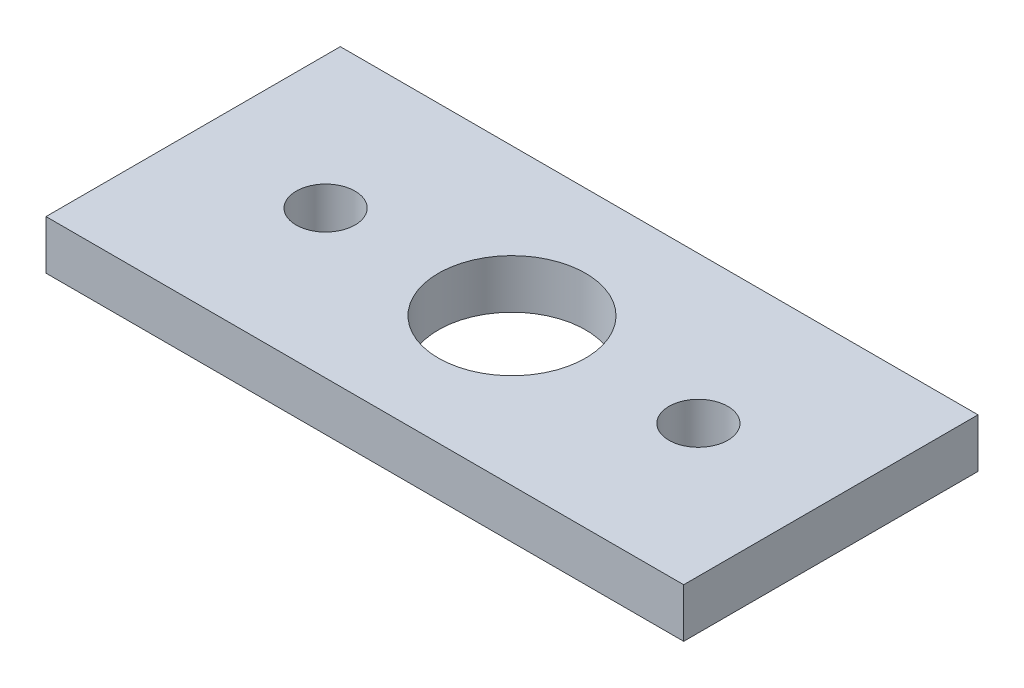
from build123d import *

# Parameters (mm, degrees)
SKETCH1_W           = 65
SKETCH1_H           = 30
SKETCH1_R           = 7.5
SKETCH1_R_2         = 3
BOSS_EXTRUDE1_DEPTH = 5


with BuildPart() as part:
    # Sketch1 → Boss-Extrude1 (new body)
    with BuildSketch(Plane(origin=(0, 0, 0), x_dir=(1, 0, 0), z_dir=(0, 1, 0))):
        with Locations((32.5, 15)):
            Rectangle(SKETCH1_W, SKETCH1_H)
        with Locations(Location((32.5, 15, 0), (0, 0, 270))):
            Circle(SKETCH1_R, mode=Mode.SUBTRACT)
        with Locations(Location((13.5, 15, 0), (0, 0, 270))):
            Circle(SKETCH1_R_2, mode=Mode.SUBTRACT)
        with Locations(Location((51.5, 15, 0), (0, 0, 90))):
            Circle(SKETCH1_R_2, mode=Mode.SUBTRACT)
    extrude(amount=BOSS_EXTRUDE1_DEPTH)


solid = part.part
